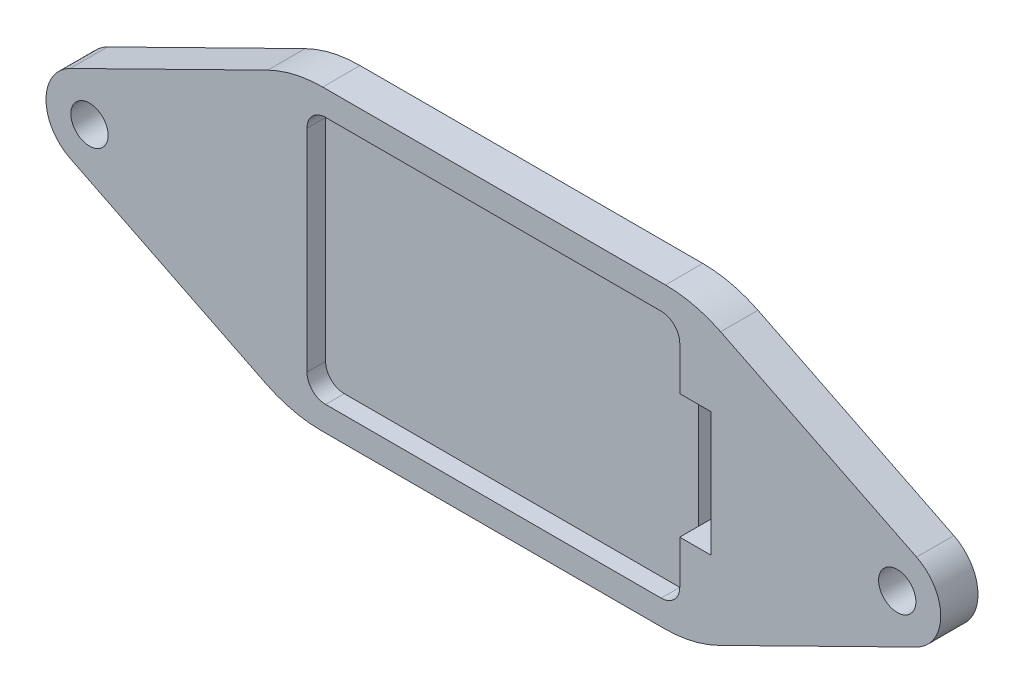
from build123d import *

# Parameters (mm, degrees)
SKETCH1_R           = 1.5
BOSS_EXTRUDE1_DEPTH = 3
BOSS_EXTRUDE2_DEPTH = 1.5


with BuildPart() as part:
    # Sketch1 → Boss-Extrude1 (new body)
    with BuildSketch(Plane.XY):
        with BuildLine():
            Line((-18.151142685, 10.970518354), (-34.046738684, 3.139681424))
            ThreePointArc((-34.046738684, 3.139681424), (-35.999996343, 0.005059225), (-34.055808986, -3.135196708))
            Line((-34.055808986, -3.135196708), (-18.292240263, -10.957704881))
            ThreePointArc((-18.292240263, -10.957704881), (-16.129937386, -11.735939832), (-13.847071731, -12))
            Line((-13.847071731, -12), (13.731889302, -12))
            ThreePointArc((13.731889302, -12), (16.000679339, -11.739229526), (18.151142685, -10.970518354))
            Line((18.151142685, -10.970518354), (34.046738684, -3.139681424))
            ThreePointArc((34.046738684, -3.139681424), (35.999996343, -0.005059225), (34.055808986, 3.135196708))
            Line((34.055808986, 3.135196708), (18.292240263, 10.957704881))
            ThreePointArc((18.292240263, 10.957704881), (16.129937386, 11.735939832), (13.847071731, 12))
            Line((13.847071731, 12), (-13.731889302, 12))
            ThreePointArc((-13.731889302, 12), (-16.000679339, 11.739229526), (-18.151142685, 10.970518354))
        make_face()
        with Locations((-32.5, 0)):
            Circle(SKETCH1_R, mode=Mode.SUBTRACT)
        with BuildLine():
            Line((13.5, -10), (-13.5, -10))
            ThreePointArc((-13.5, -10), (-14.560660172, -9.560660172), (-15, -8.5))
            Line((-15, -8.5), (-15, 8.5))
            ThreePointArc((-15, 8.5), (-14.560660172, 9.560660172), (-13.5, 10))
            Line((-13.5, 10), (13.5, 10))
            ThreePointArc((13.5, 10), (14.560660172, 9.560660172), (15, 8.5))
            Line((15, 8.5), (15, 5))
            Line((15, 5), (17.5, 5))
            Line((17.5, 5), (17.5, -5))
            Line((17.5, -5), (15, -5))
            Line((15, -5), (15, -8.5))
            ThreePointArc((15, -8.5), (14.560660172, -9.560660172), (13.5, -10))
        make_face(mode=Mode.SUBTRACT)
        with Locations((32.5, 0)):
            Circle(SKETCH1_R, mode=Mode.SUBTRACT)
    extrude(amount=BOSS_EXTRUDE1_DEPTH)

    # Sketch1<3> → Boss-Extrude2 (add)
    with BuildSketch(Plane.XY):
        with BuildLine():
            ThreePointArc((-15, -8.5), (-14.560660172, -9.560660172), (-13.5, -10))
            Line((-13.5, -10), (13.5, -10))
            ThreePointArc((13.5, -10), (14.560660172, -9.560660172), (15, -8.5))
            Line((15, -8.5), (15, -5))
            Line((15, -5), (15, 5))
            Line((15, 5), (15, 8.5))
            ThreePointArc((15, 8.5), (14.560660172, 9.560660172), (13.5, 10))
            Line((13.5, 10), (-13.5, 10))
            ThreePointArc((-13.5, 10), (-14.560660172, 9.560660172), (-15, 8.5))
            Line((-15, 8.5), (-15, -8.5))
        make_face()
    extrude(amount=BOSS_EXTRUDE2_DEPTH)


solid = part.part
